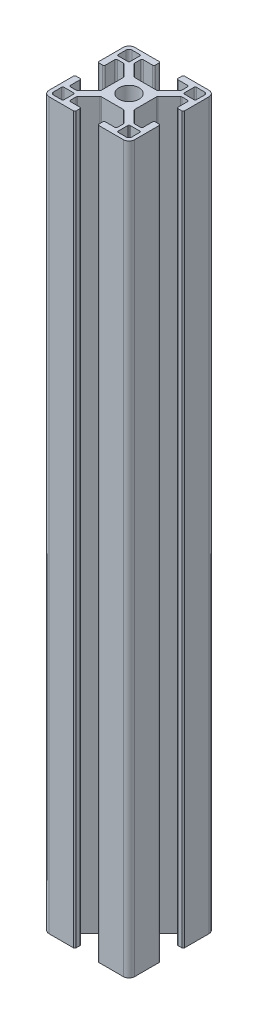
from build123d import *

# Parameters (mm, degrees)
SKETCH1_R           = 3.52998588
BOSS_EXTRUDE1_DEPTH = 127


with BuildPart() as part:
    # Sketch1 → Boss-Extrude1 (new, symmetric)
    with BuildSketch(Plane(origin=(0, 0, 0), x_dir=(1, 0, 0), z_dir=(0, 1, 0))):
        with BuildLine():
            Line((14.49994, -4), (13.24247465, -4))
            ThreePointArc((13.24247465, -4), (12.88892126, -4.146446609), (12.74247465, -4.5))
            Line((12.74247465, -4.5), (12.74247465, -7.732519321))
            ThreePointArc((12.74247465, -7.732519321), (12.602449697, -8.097296796), (12.242781236, -8.249967))
            Line((12.242781236, -8.249967), (10.260188032, -8.249967))
            ThreePointArc((10.260188032, -8.249967), (10.068847082, -8.211906919), (9.906636056, -8.103520976))
            Line((9.906636056, -8.103520976), (5.981117769, -4.178002689))
            ThreePointArc((5.981117769, -4.178002689), (5.872731827, -4.015791664), (5.834671745, -3.824450713))
            Line((5.834671745, -3.824450713), (5.834671745, -1.01249595))
            Line((5.834671745, -1.01249595), (5.834671745, 0.88749645))
            Line((5.834671745, 0.88749645), (5.834671745, 3.824450713))
            ThreePointArc((5.834671745, 3.824450713), (5.872731827, 4.015791664), (5.981117769, 4.178002689))
            Line((5.981117769, 4.178002689), (9.906636056, 8.103520976))
            ThreePointArc((9.906636056, 8.103520976), (10.068847082, 8.211906919), (10.260188032, 8.249967))
            Line((10.260188032, 8.249967), (12.242781236, 8.249967))
            ThreePointArc((12.242781236, 8.249967), (12.602449697, 8.097296796), (12.74247465, 7.732519321))
            Line((12.74247465, 7.732519321), (12.74247465, 4.5))
            ThreePointArc((12.74247465, 4.5), (12.88892126, 4.146446609), (13.24247465, 4))
            Line((13.24247465, 4), (14.49994, 4))
            ThreePointArc((14.49994, 4), (14.853493391, 4.146446609), (14.99994, 4.5))
            Line((14.99994, 4.5), (14.99994, 12.999948))
            ThreePointArc((14.99994, 12.999948), (14.414155906, 14.414155906), (12.999948, 14.99994))
            Line((12.999948, 14.99994), (4.5, 14.99994))
            ThreePointArc((4.5, 14.99994), (4.146446609, 14.853493391), (4, 14.49994))
            Line((4, 14.49994), (4, 13.24247465))
            ThreePointArc((4, 13.24247465), (4.146446609, 12.88892126), (4.5, 12.74247465))
            Line((4.5, 12.74247465), (7.732519321, 12.74247465))
            ThreePointArc((7.732519321, 12.74247465), (8.097296796, 12.602449697), (8.249967, 12.242781236))
            Line((8.249967, 12.242781236), (8.249967, 10.260188032))
            ThreePointArc((8.249967, 10.260188032), (8.211906919, 10.068847082), (8.103520976, 9.906636056))
            Line((8.103520976, 9.906636056), (4.178002689, 5.981117769))
            ThreePointArc((4.178002689, 5.981117769), (4.015791664, 5.872731827), (3.824450713, 5.834671745))
            Line((3.824450713, 5.834671745), (0.9499962, 5.834671745))
            Line((0.9499962, 5.834671745), (-0.9499962, 5.834671745))
            Line((-0.9499962, 5.834671745), (-3.824450713, 5.834671745))
            ThreePointArc((-3.824450713, 5.834671745), (-4.015791664, 5.872731827), (-4.178002689, 5.981117769))
            Line((-4.178002689, 5.981117769), (-8.103520976, 9.906636056))
            ThreePointArc((-8.103520976, 9.906636056), (-8.211906919, 10.068847082), (-8.249967, 10.260188032))
            Line((-8.249967, 10.260188032), (-8.249967, 12.242781236))
            ThreePointArc((-8.249967, 12.242781236), (-8.097296796, 12.602449697), (-7.732519321, 12.74247465))
            Line((-7.732519321, 12.74247465), (-4.5, 12.74247465))
            ThreePointArc((-4.5, 12.74247465), (-4.146446609, 12.88892126), (-4, 13.24247465))
            Line((-4, 13.24247465), (-4, 14.49994))
            ThreePointArc((-4, 14.49994), (-4.146446609, 14.853493391), (-4.5, 14.99994))
            Line((-4.5, 14.99994), (-12.999948, 14.99994))
            ThreePointArc((-12.999948, 14.99994), (-14.414155906, 14.414155906), (-14.99994, 12.999948))
            Line((-14.99994, 12.999948), (-14.99994, 4.5))
            ThreePointArc((-14.99994, 4.5), (-14.853493391, 4.146446609), (-14.49994, 4))
            Line((-14.49994, 4), (-13.24247465, 4))
            ThreePointArc((-13.24247465, 4), (-12.88892126, 4.146446609), (-12.74247465, 4.5))
            Line((-12.74247465, 4.5), (-12.74247465, 7.732519321))
            ThreePointArc((-12.74247465, 7.732519321), (-12.602449697, 8.097296796), (-12.242781236, 8.249967))
            Line((-12.242781236, 8.249967), (-10.260188032, 8.249967))
            ThreePointArc((-10.260188032, 8.249967), (-10.068847082, 8.211906919), (-9.906636056, 8.103520976))
            Line((-9.906636056, 8.103520976), (-5.981117769, 4.178002689))
            ThreePointArc((-5.981117769, 4.178002689), (-5.872731827, 4.015791664), (-5.834671745, 3.824450713))
            Line((-5.834671745, 3.824450713), (-5.834671745, 0.88749645))
            Line((-5.834671745, 0.88749645), (-5.834671745, -1.01249595))
            Line((-5.834671745, -1.01249595), (-5.834671745, -3.824450713))
            ThreePointArc((-5.834671745, -3.824450713), (-5.872731827, -4.015791664), (-5.981117769, -4.178002689))
            Line((-5.981117769, -4.178002689), (-9.906636056, -8.103520976))
            ThreePointArc((-9.906636056, -8.103520976), (-10.068847082, -8.211906919), (-10.260188032, -8.249967))
            Line((-10.260188032, -8.249967), (-12.242781236, -8.249967))
            ThreePointArc((-12.242781236, -8.249967), (-12.602449697, -8.097296796), (-12.74247465, -7.732519321))
            Line((-12.74247465, -7.732519321), (-12.74247465, -4.5))
            ThreePointArc((-12.74247465, -4.5), (-12.88892126, -4.146446609), (-13.24247465, -4))
            Line((-13.24247465, -4), (-14.49994, -4))
            ThreePointArc((-14.49994, -4), (-14.853493391, -4.146446609), (-14.99994, -4.5))
            Line((-14.99994, -4.5), (-14.99994, -12.999948))
            ThreePointArc((-14.99994, -12.999948), (-14.414155906, -14.414155906), (-12.999948, -14.99994))
            Line((-12.999948, -14.99994), (-4.5, -14.99994))
            ThreePointArc((-4.5, -14.99994), (-4.146446609, -14.853493391), (-4, -14.49994))
            Line((-4, -14.49994), (-4, -13.24247465))
            ThreePointArc((-4, -13.24247465), (-4.146446609, -12.88892126), (-4.5, -12.74247465))
            Line((-4.5, -12.74247465), (-7.732519321, -12.74247465))
            ThreePointArc((-7.732519321, -12.74247465), (-8.097296796, -12.602449697), (-8.249967, -12.242781236))
            Line((-8.249967, -12.242781236), (-8.249967, -10.260188032))
            ThreePointArc((-8.249967, -10.260188032), (-8.211906919, -10.068847082), (-8.103520976, -9.906636056))
            Line((-8.103520976, -9.906636056), (-4.178002689, -5.981117769))
            ThreePointArc((-4.178002689, -5.981117769), (-4.015791664, -5.872731827), (-3.824450713, -5.834671745))
            Line((-3.824450713, -5.834671745), (-0.9499962, -5.834671745))
            Line((-0.9499962, -5.834671745), (0.9499962, -5.834671745))
            Line((0.9499962, -5.834671745), (3.824450713, -5.834671745))
            ThreePointArc((3.824450713, -5.834671745), (4.015791664, -5.872731827), (4.178002689, -5.981117769))
            Line((4.178002689, -5.981117769), (8.103520976, -9.906636056))
            ThreePointArc((8.103520976, -9.906636056), (8.211906919, -10.068847082), (8.249967, -10.260188032))
            Line((8.249967, -10.260188032), (8.249967, -12.242781236))
            ThreePointArc((8.249967, -12.242781236), (8.097296796, -12.602449697), (7.732519321, -12.74247465))
            Line((7.732519321, -12.74247465), (4.5, -12.74247465))
            ThreePointArc((4.5, -12.74247465), (4.146446609, -12.88892126), (4, -13.24247465))
            Line((4, -13.24247465), (4, -14.49994))
            ThreePointArc((4, -14.49994), (4.146446609, -14.853493391), (4.5, -14.99994))
            Line((4.5, -14.99994), (12.999948, -14.99994))
            ThreePointArc((12.999948, -14.99994), (14.414155906, -14.414155906), (14.99994, -12.999948))
            Line((14.99994, -12.999948), (14.99994, -4.5))
            ThreePointArc((14.99994, -4.5), (14.853493391, -4.146446609), (14.49994, -4))
        make_face()
        with Locations(Location((0, 0, 0), (0, 0, 270))):
            Circle(SKETCH1_R, mode=Mode.SUBTRACT)
        with BuildLine():
            Line((-12.6999492, -13.6999452), (-9.880960476, -13.6999452))
            ThreePointArc((-9.880960476, -13.6999452), (-9.61155387, -13.58835333), (-9.499962, -13.318946724))
            Line((-9.499962, -13.318946724), (-9.499962, -9.87996048))
            ThreePointArc((-9.499962, -9.87996048), (-9.611260978, -9.611260978), (-9.87996048, -9.499962))
            Line((-9.87996048, -9.499962), (-13.318946724, -9.499962))
            ThreePointArc((-13.318946724, -9.499962), (-13.58835333, -9.61155387), (-13.6999452, -9.880960476))
            Line((-13.6999452, -9.880960476), (-13.6999452, -12.6999492))
            ThreePointArc((-13.6999452, -12.6999492), (-13.407053153, -13.407053153), (-12.6999492, -13.6999452))
        make_face(mode=Mode.SUBTRACT)
        with BuildLine():
            Line((13.6999452, -12.6999492), (13.6999452, -9.880960476))
            ThreePointArc((13.6999452, -9.880960476), (13.58835333, -9.61155387), (13.318946724, -9.499962))
            Line((13.318946724, -9.499962), (9.87996048, -9.499962))
            ThreePointArc((9.87996048, -9.499962), (9.611260978, -9.611260978), (9.499962, -9.87996048))
            Line((9.499962, -9.87996048), (9.499962, -13.318946724))
            ThreePointArc((9.499962, -13.318946724), (9.61155387, -13.58835333), (9.880960476, -13.6999452))
            Line((9.880960476, -13.6999452), (12.6999492, -13.6999452))
            ThreePointArc((12.6999492, -13.6999452), (13.407053153, -13.407053153), (13.6999452, -12.6999492))
        make_face(mode=Mode.SUBTRACT)
        with BuildLine():
            Line((9.87996048, 9.499962), (13.318946724, 9.499962))
            ThreePointArc((13.318946724, 9.499962), (13.58835333, 9.61155387), (13.6999452, 9.880960476))
            Line((13.6999452, 9.880960476), (13.6999452, 12.6999492))
            ThreePointArc((13.6999452, 12.6999492), (13.407053153, 13.407053153), (12.6999492, 13.6999452))
            Line((12.6999492, 13.6999452), (9.880960476, 13.6999452))
            ThreePointArc((9.880960476, 13.6999452), (9.61155387, 13.58835333), (9.499962, 13.318946724))
            Line((9.499962, 13.318946724), (9.499962, 9.87996048))
            ThreePointArc((9.499962, 9.87996048), (9.611260978, 9.611260978), (9.87996048, 9.499962))
        make_face(mode=Mode.SUBTRACT)
        with BuildLine():
            Line((-13.6999452, 12.6999492), (-13.6999452, 9.880960476))
            ThreePointArc((-13.6999452, 9.880960476), (-13.58835333, 9.61155387), (-13.318946724, 9.499962))
            Line((-13.318946724, 9.499962), (-9.87996048, 9.499962))
            ThreePointArc((-9.87996048, 9.499962), (-9.611260978, 9.611260978), (-9.499962, 9.87996048))
            Line((-9.499962, 9.87996048), (-9.499962, 13.318946724))
            ThreePointArc((-9.499962, 13.318946724), (-9.61155387, 13.58835333), (-9.880960476, 13.6999452))
            Line((-9.880960476, 13.6999452), (-12.6999492, 13.6999452))
            ThreePointArc((-12.6999492, 13.6999452), (-13.407053153, 13.407053153), (-13.6999452, 12.6999492))
        make_face(mode=Mode.SUBTRACT)
    extrude(amount=BOSS_EXTRUDE1_DEPTH, both=True)


solid = part.part
